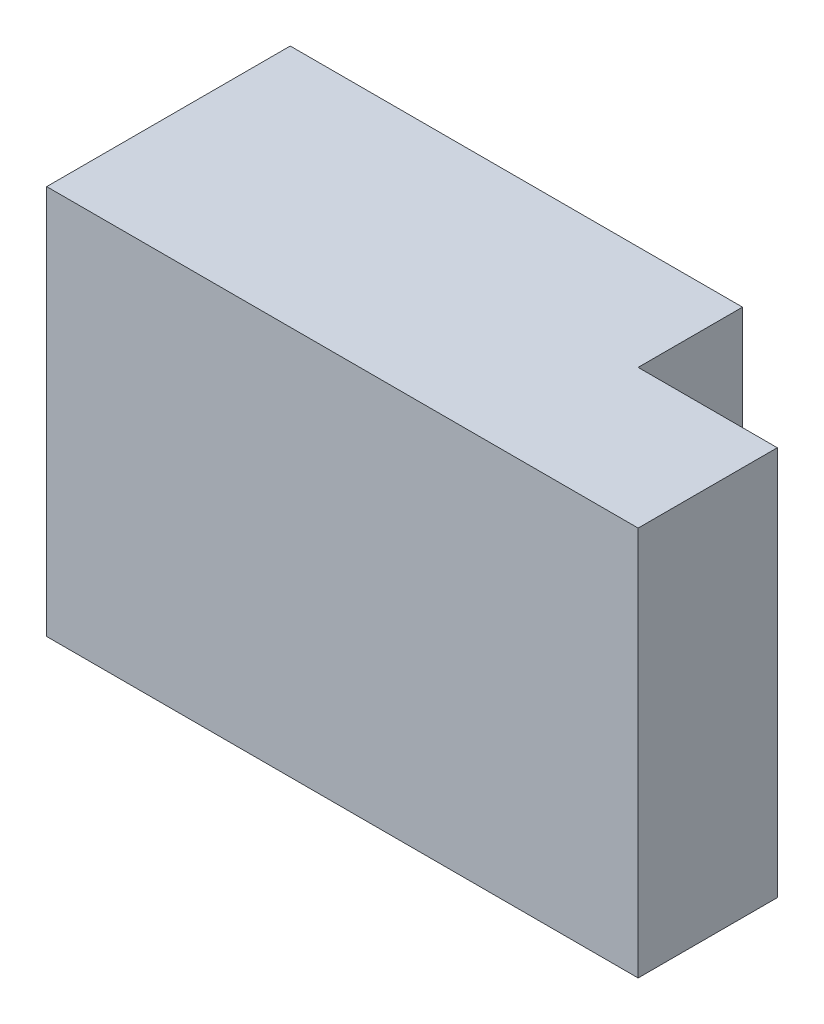
from build123d import *

# Parameters (mm, degrees)
SKETCH_1_W      = 65
SKETCH_1_H      = 56
SKETCH_1_R      = 1.35
EXTRUDE_1_DEPTH = 15
SKETCH_2_W      = 85
SKETCH_2_H      = 56
EXTRUDE_2_DEPTH = 20


with BuildPart() as part:
    # 草图1 → 凸台-拉伸1 (new body)
    with BuildSketch(Plane.XY):
        Rectangle(SKETCH_1_W, SKETCH_1_H)
        with Locations((-29, 24.5)):
            Circle(SKETCH_1_R, mode=Mode.SUBTRACT)
        with Locations(Location((29, 24.5, 0), (0, 0, 180))):
            Circle(SKETCH_1_R, mode=Mode.SUBTRACT)
        with Locations(Location((-29, -24.5, 0), (0, 0, 180))):
            Circle(SKETCH_1_R, mode=Mode.SUBTRACT)
        with Locations((29, -24.5)):
            Circle(SKETCH_1_R, mode=Mode.SUBTRACT)
    extrude(amount=EXTRUDE_1_DEPTH)

    # 草图2 → 凸台-拉伸2 (add)
    with BuildSketch(Plane.XY.offset(15)):
        with Locations((10, 0)):
            Rectangle(SKETCH_2_W, SKETCH_2_H)
    extrude(amount=EXTRUDE_2_DEPTH)


solid = part.part
